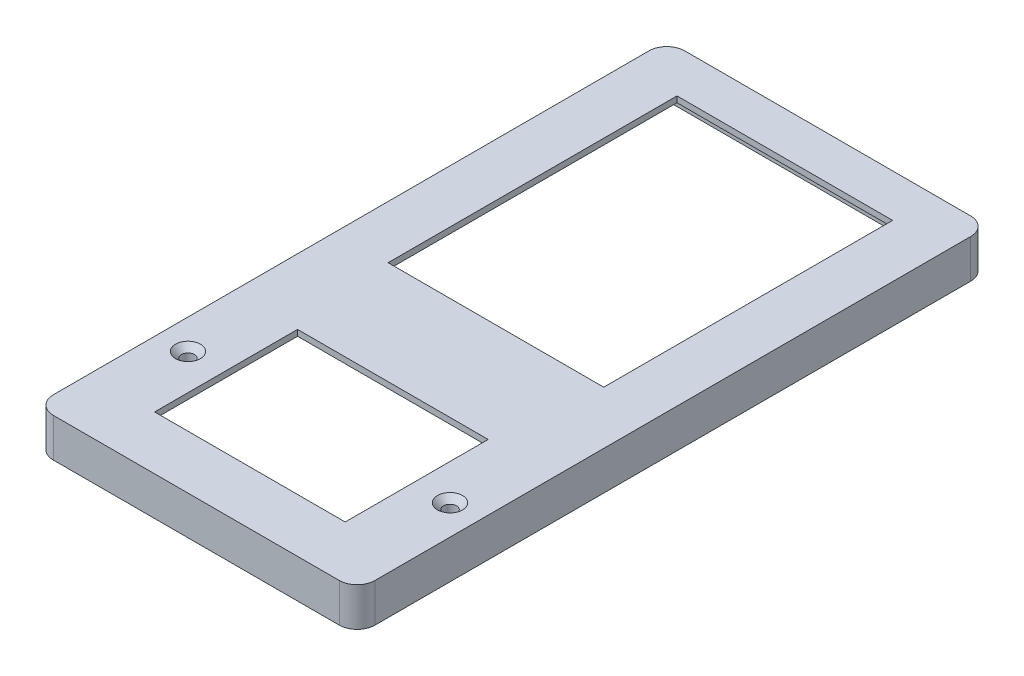
from build123d import *

# Parameters (mm, degrees)
SKETCH1_W           = 54
SKETCH1_H           = 106
SKETCH1_W_2         = 49.5
SKETCH1_H_2         = 101.5
BOSS_EXTRUDE1_DEPTH = 5.5
SKETCH2_W           = 54
SKETCH2_H           = 106
SKETCH2_W_2         = 36.2
SKETCH2_H_2         = 48.5
SKETCH2_W_3         = 32
SKETCH2_H_3         = 24
BOSS_EXTRUDE2_DEPTH = 1
BOSS_EXTRUDE3_DEPTH = 2
SKETCH4_R           = 3
BOSS_EXTRUDE4_DEPTH = 2
SKETCH5_R           = 1.1
CUT_EXTRUDE1_DEPTH  = 60.73483071
FILLET1_R           = 3
CHAMFER1_SIZE       = 1
SKETCH6_W           = 49.5
SKETCH6_H           = 1
CUT_EXTRUDE2_DEPTH  = 2


with BuildPart() as part:
    # Sketch1 → Boss-Extrude1 (new body)
    with BuildSketch(Plane(origin=(0, 0, 0), x_dir=(1, 0, 0), z_dir=(0, 1, 0))):
        Rectangle(SKETCH1_W, SKETCH1_H)
        Rectangle(SKETCH1_W_2, SKETCH1_H_2, mode=Mode.SUBTRACT)
    extrude(amount=-BOSS_EXTRUDE1_DEPTH)

    # Sketch2 → Boss-Extrude2 (add)
    with BuildSketch(Plane(origin=(0, 0, 0), x_dir=(1, 0, 0), z_dir=(0, 1, 0))):
        Rectangle(SKETCH2_W, SKETCH2_H)
        with Locations((0, 21.55)):
            Rectangle(SKETCH2_W_2, SKETCH2_H_2, mode=Mode.SUBTRACT)
        with Locations((0, -32)):
            Rectangle(SKETCH2_W_3, SKETCH2_H_3, mode=Mode.SUBTRACT)
    extrude(amount=BOSS_EXTRUDE2_DEPTH)

    # Sketch3 → Boss-Extrude3 (add)
    with BuildSketch(Plane.XZ):
        Polygon((21.5, 11.5715), (17.5, 11.5715), (17.5, 15.0715), (25, 15.0715), (25, -52.4285), (-25, -52.4285), (-25, 15.0715), (-17.5, 15.0715), (-17.5, 11.5715), (-21.5, 11.5715), (-21.5, -48.9285), (21.5, -48.9285), align=None)
    extrude(amount=BOSS_EXTRUDE3_DEPTH)

    # Sketch4 → Boss-Extrude4 (add)
    with BuildSketch(Plane.XZ):
        with Locations((-22, 32.4)):
            Circle(SKETCH4_R)
    boss_extrude4 = extrude(amount=BOSS_EXTRUDE4_DEPTH)

    # Sketch5 → Cut-Extrude1 (cut, symmetric)
    with BuildSketch(Plane.XZ):
        with Locations(Location((-22, 32.4, 0), (0, 0, 270))):
            Circle(SKETCH5_R)
    cut_extrude1 = extrude(amount=CUT_EXTRUDE1_DEPTH, both=True, mode=Mode.SUBTRACT)

    # Mirror1: Boss-Extrude4, Cut-Extrude1 across plane
    add(boss_extrude4.mirror(Plane(origin=(0, 0, 0), x_dir=(0, 0, 1), z_dir=(1, 0, 0))))
    add(cut_extrude1.mirror(Plane(origin=(0, 0, 0), x_dir=(0, 0, 1), z_dir=(1, 0, 0))), mode=Mode.SUBTRACT)

    # Fillet1
    fillet1_edges = [part.edges().sort_by_distance(p)[0] for p in [
        (-27, -2.25, -53),
        (27, -2.25, -53),
        (27, -2.25, 53),
        (-27, -2.25, 53),
    ]]
    fillet(fillet1_edges, radius=FILLET1_R)

    # Chamfer1
    chamfer1_edges = [part.edges().sort_by_distance(p)[0] for p in [
        (-22, 1, 33.5),
        (22, 1, 33.5),
    ]]
    chamfer(chamfer1_edges, length=CHAMFER1_SIZE)

    # Sketch6 → Cut-Extrude2 (cut)
    with BuildSketch(Plane.XZ.offset(5.5)):
        with Locations((0, 51.25)):
            Rectangle(SKETCH6_W, SKETCH6_H)
    extrude(amount=-CUT_EXTRUDE2_DEPTH, mode=Mode.SUBTRACT)


solid = part.part
